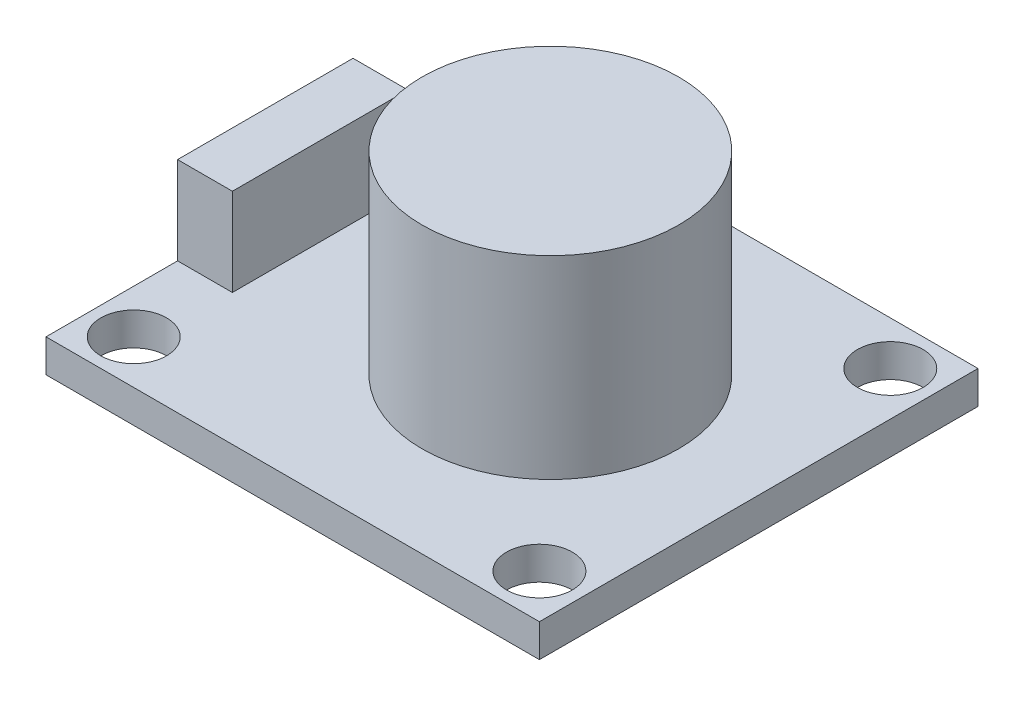
from build123d import *

# Parameters (mm, degrees)
SKETCH_1_W      = 22.5
SKETCH_1_H      = 20
SKETCH_1_R      = 1.5
EXTRUDE_1_DEPTH = 1.5
SKETCH_1_3_R    = 5.85
EXTRUDE_2_DEPTH = 8.84
SKETCH_1_4_W    = 2.5
SKETCH_1_4_H    = 8
EXTRUDE_3_DEPTH = 4


with BuildPart() as part:
    # 草图1 → 凸台-拉伸1 (new body)
    with BuildSketch(Plane(origin=(0, 0, 0), x_dir=(1, 0, 0), z_dir=(0, 1, 0))):
        with Locations((11.25, 10)):
            Rectangle(SKETCH_1_W, SKETCH_1_H)
        with Locations((2, 2)):
            Circle(SKETCH_1_R, mode=Mode.SUBTRACT)
        with Locations((20.5, 2)):
            Circle(SKETCH_1_R, mode=Mode.SUBTRACT)
        with Locations((2, 18)):
            Circle(SKETCH_1_R, mode=Mode.SUBTRACT)
        with Locations((20.5, 18)):
            Circle(SKETCH_1_R, mode=Mode.SUBTRACT)
    extrude(amount=-EXTRUDE_1_DEPTH)

    # 草图1<3> → 凸台-拉伸2 (add)
    with BuildSketch(Plane(origin=(0, 0, 0), x_dir=(1, 0, 0), z_dir=(0, 1, 0))):
        with Locations((13, 10)):
            Circle(SKETCH_1_3_R)
    extrude(amount=EXTRUDE_2_DEPTH)

    # 草图1<4> → 凸台-拉伸3 (add)
    with BuildSketch(Plane(origin=(0, 0, 0), x_dir=(1, 0, 0), z_dir=(0, 1, 0))):
        with Locations((1.25, 10)):
            Rectangle(SKETCH_1_4_W, SKETCH_1_4_H)
    extrude(amount=EXTRUDE_3_DEPTH)


solid = part.part
